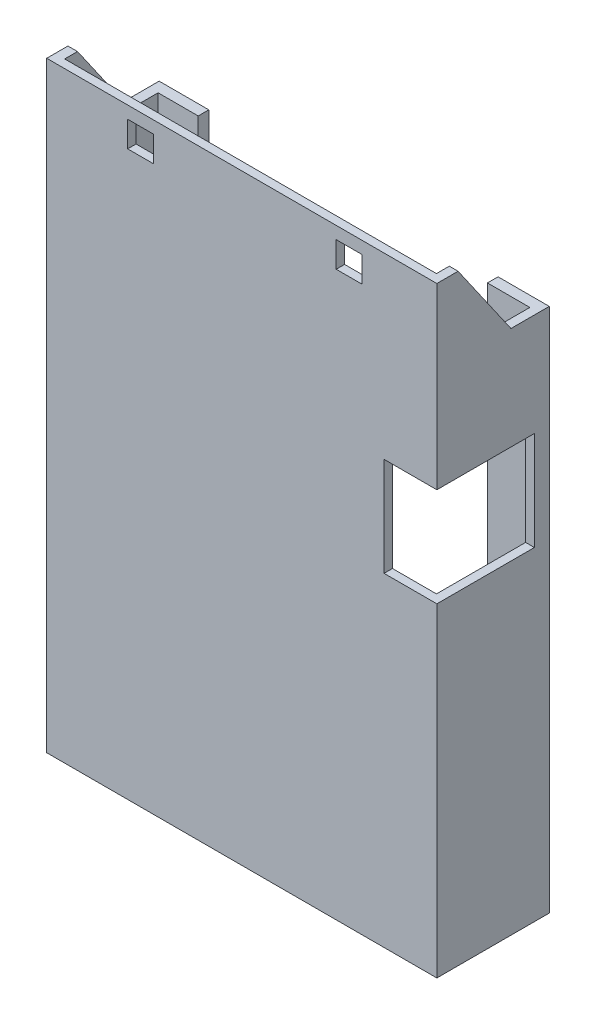
from build123d import *

# Parameters (mm, degrees)
BOSS_EXTRUDE2_DEPTH      = 34.479411165
BOSS_EXTRUDE2_DEPTH_BACK = 0.1
SKETCH4_W                = 120
SKETCH4_H                = 185
SKETCH7_W                = 88.965159514
SKETCH7_H                = 168.79001582
CUT_EXTRUDE1_DEPTH       = 32
SKETCH8_W                = 38.11885966
SKETCH8_H                = 26.011926246
CUT_EXTRUDE2_DEPTH       = 32
SKETCH12_W               = 12.33668545
SKETCH12_H               = 28.735157877
SKETCH12_W_2             = 13.054734016
CUT_EXTRUDE10_DEPTH      = 169
CUT_EXTRUDE11_DEPTH      = 156.38687137
CUT_EXTRUDE11_DEPTH_BACK = 120
SKETCH14_W               = 7.893435911
SKETCH14_H               = 7.893435911
SKETCH14_W_2             = 7.893435912
CUT_EXTRUDE13_DEPTH      = 120
SKETCH16_W               = 16.234881207
SKETCH16_H               = 30.372514135
CUT_EXTRUDE15_DEPTH      = 30


with BuildPart() as part:
    # Sketch4 → Boss-Extrude2 (new, two sides: drawn at the far end of the back side and taken through both)
    with BuildSketch(Plane.XY.offset(-BOSS_EXTRUDE2_DEPTH_BACK)):
        Rectangle(SKETCH4_W, SKETCH4_H)
    extrude(amount=BOSS_EXTRUDE2_DEPTH + BOSS_EXTRUDE2_DEPTH_BACK)

    # Sketch7 → Cut-Extrude1 (cut)
    with BuildSketch(Plane(origin=(0, 0, -0.1), x_dir=(-1, 0, 0), z_dir=(0, 0, -1))):
        with Locations((0.239153655, 8.10499209)):
            Rectangle(SKETCH7_W, SKETCH7_H)
    extrude(amount=-CUT_EXTRUDE1_DEPTH, mode=Mode.SUBTRACT)

    # Sketch8 → Cut-Extrude2 (cut)
    with BuildSketch(Plane(origin=(0, -76.29001582, 0), x_dir=(1, 0, 0), z_dir=(0, 1, 0))):
        with Locations((0.239741256, -16.26190688)):
            Rectangle(SKETCH8_W, SKETCH8_H)
    extrude(amount=-CUT_EXTRUDE2_DEPTH, mode=Mode.SUBTRACT)

    # Sketch12 → Cut-Extrude10 (cut)
    with BuildSketch(Plane(origin=(0, 92.5, 0), x_dir=(1, 0, 0), z_dir=(0, 1, 0))):
        with Locations((-50.890076137, -17.532421062)):
            Rectangle(SKETCH12_W, SKETCH12_H)
        with Locations((50.77079311, -17.532421062)):
            Rectangle(SKETCH12_W_2, SKETCH12_H)
    extrude(amount=-CUT_EXTRUDE10_DEPTH, mode=Mode.SUBTRACT)

    # Sketch13 → Cut-Extrude11 (cut, two sides: drawn at the far end of the back side and taken through both)
    with BuildSketch(Plane(origin=(60, 0, 0), x_dir=(0, 0, -1), z_dir=(1, 0, 0)).offset(-CUT_EXTRUDE11_DEPTH_BACK)):
        Polygon((-247.325576021, 407.948170503), (-27.952099996, 92.5), (-11.689651482, 69.115406181), (0.1, 69.115406181), (384.329450013, 69.115406181), (747.583784475, 746.297338547), (115.928758441, 1085.130102868), align=None)
    extrude(amount=CUT_EXTRUDE11_DEPTH + CUT_EXTRUDE11_DEPTH_BACK, mode=Mode.SUBTRACT)

    # Sketch14 → Cut-Extrude13 (cut)
    with BuildSketch(Plane(origin=(0, 0, 31.9), x_dir=(-1, 0, 0), z_dir=(0, 0, -1))):
        with Locations((-32.983285774, 84.758555925)):
            Rectangle(SKETCH14_W, SKETCH14_H)
        with Locations((31.155523105, 84.758555925)):
            Rectangle(SKETCH14_W_2, SKETCH14_H)
    extrude(amount=-CUT_EXTRUDE13_DEPTH, mode=Mode.SUBTRACT)

    # Sketch16 → Cut-Extrude15 (cut)
    with BuildSketch(Plane.XY.offset(34.479411165)):
        with Locations((51.882559396, 22.360866706)):
            Rectangle(SKETCH16_W, SKETCH16_H)
    extrude(amount=-CUT_EXTRUDE15_DEPTH, mode=Mode.SUBTRACT)


solid = part.part
